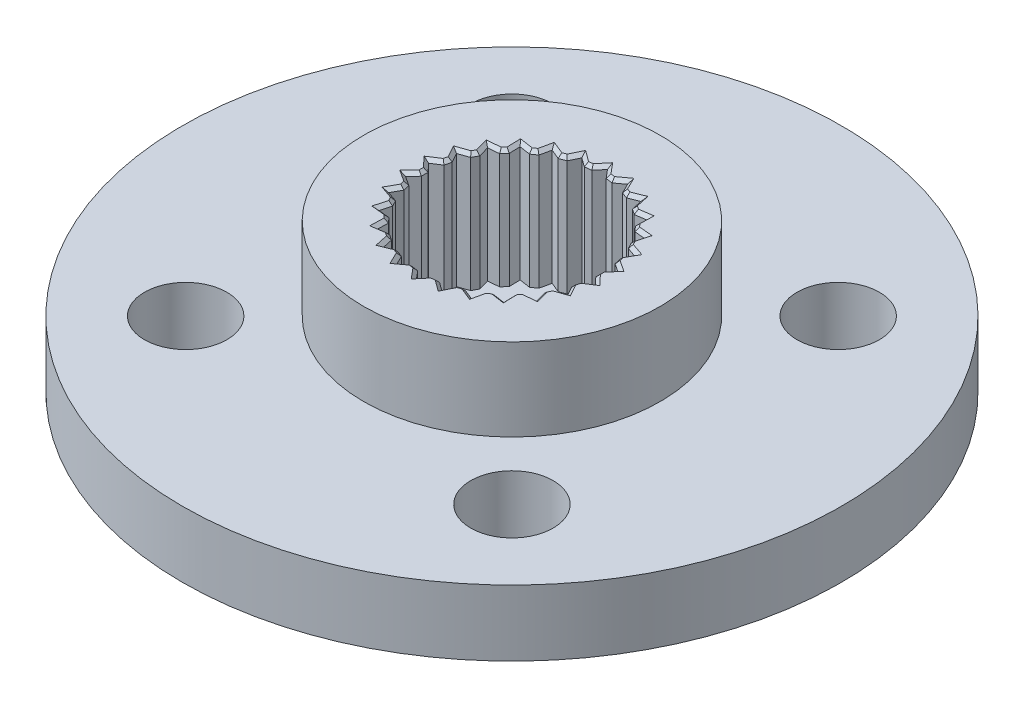
from build123d import *

# Parameters (mm, degrees)
SKETCH1_R           = 10
SKETCH1_R_2         = 1.25
SKETCH1_R_3         = 1.5
BOSS_EXTRUDE1_DEPTH = 2
SKETCH2_R           = 4.5
SKETCH2_R_2         = 1.5
BOSS_EXTRUDE2_DEPTH = 2.5
SKETCH3_R           = 2.25
CUT_EXTRUDE1_DEPTH  = 3.6
CUT_EXTRUDE2_DEPTH  = 3.6
CHAMFER1_SIZE       = 0.1


with BuildPart() as part:
    # Sketch1 → Boss-Extrude1 (new body)
    with BuildSketch(Plane(origin=(0, 0, 0), x_dir=(1, 0, 0), z_dir=(0, 1, 0))):
        with Locations(Location((0, 0, 0), (0, 0, 270))):
            Circle(SKETCH1_R)
        with Locations(Location((-4.949747468, 4.949747468, 0), (0, 0, 270))):
            Circle(SKETCH1_R_2, mode=Mode.SUBTRACT)
        with Locations(Location((4.949747468, 4.949747468, 0), (0, 0, 270))):
            Circle(SKETCH1_R_2, mode=Mode.SUBTRACT)
        with Locations(Location((4.949747468, -4.949747468, 0), (0, 0, 270))):
            Circle(SKETCH1_R_2, mode=Mode.SUBTRACT)
        with Locations(Location((-4.949747468, -4.949747468, 0), (0, 0, 270))):
            Circle(SKETCH1_R_2, mode=Mode.SUBTRACT)
        with Locations(Location((0, 0, 0), (0, 0, 270))):
            Circle(SKETCH1_R_3, mode=Mode.SUBTRACT)
    extrude(amount=BOSS_EXTRUDE1_DEPTH)

    # Sketch2 → Boss-Extrude2 (add)
    with BuildSketch(Plane(origin=(0, 2, 0), x_dir=(1, 0, 0), z_dir=(0, 1, 0))):
        with Locations(Location((0, 0, 0), (0, 0, 270))):
            Circle(SKETCH2_R)
        with Locations(Location((0, 0, 0), (0, 0, 270))):
            Circle(SKETCH2_R_2, mode=Mode.SUBTRACT)
    extrude(amount=BOSS_EXTRUDE2_DEPTH)

    # Sketch3 → Cut-Extrude1 (cut)
    with BuildSketch(Plane(origin=(0, 4.5, 0), x_dir=(1, 0, 0), z_dir=(0, 1, 0))):
        with Locations(Location((0, 0, 0), (0, 0, 270))):
            Circle(SKETCH3_R)
    extrude(amount=-CUT_EXTRUDE1_DEPTH, mode=Mode.SUBTRACT)

    # Sketch7 → Cut-Extrude2 (cut)
    with BuildSketch(Plane(origin=(0, 4.5, 0), x_dir=(1, 0, 0), z_dir=(0, 1, 0))):
        Polygon((-0.842998944, 2.512340101), (-1.034995876, 2.439525269), (-1.129082655, 2.478127827), (-1.347697199, 2.567822474), (-1.398067166, 2.336953865), (-1.419745267, 2.237593211), (-1.588737387, 2.120946373), (-1.689328372, 2.13591077), (-1.923055709, 2.17068117), (-1.916711542, 1.93446686), (-1.913981155, 1.832805537), (-2.050147256, 1.679105783), (-2.151396465, 1.669562343), (-2.386653211, 1.647387766), (-2.32396361, 1.419555673), (-2.296983416, 1.321501868), (-2.392410018, 1.139681668), (-2.488433215, 1.106185022), (-2.711547104, 1.028354172), (-2.59615536, 0.82214507), (-2.54649335, 0.733397313), (-2.595634607, 0.534023397), (-2.680851271, 0.478520248), (-2.878855735, 0.349556373), (-2.717467997, 0.176954384), (-2.648010346, 0.102670372), (-2.648010346, -0.102670372), (-2.717467997, -0.176954384), (-2.878855735, -0.349556373), (-2.680851271, -0.478520248), (-2.595634607, -0.534023397), (-2.54649335, -0.733397313), (-2.59615536, -0.82214507), (-2.711547104, -1.028354172), (-2.488433215, -1.106185022), (-2.392410018, -1.139681668), (-2.296983416, -1.321501868), (-2.32396361, -1.419555673), (-2.386653211, -1.647387766), (-2.151396465, -1.669562343), (-2.050147256, -1.679105783), (-1.913981155, -1.832805537), (-1.916711542, -1.93446686), (-1.923055709, -2.17068117), (-1.689328372, -2.13591077), (-1.588737387, -2.120946373), (-1.419745267, -2.237593211), (-1.398067166, -2.336953865), (-1.347697199, -2.567822474), (-1.129082655, -2.478127827), (-1.034995876, -2.439525269), (-0.842998944, -2.512340101), (-0.798172209, -2.603625605), (-0.694015426, -2.815731271), (-0.503218758, -2.676325101), (-0.421104166, -2.616327824), (-0.217260587, -2.641078915), (-0.151890384, -2.718984089), (0, -2.9), (0.151890384, -2.718984089), (0.217260587, -2.641078915), (0.421104166, -2.616327824), (0.503218758, -2.676325101), (0.694015426, -2.815731271), (0.798172209, -2.603625605), (0.842998944, -2.512340101), (1.034995876, -2.439525269), (1.129082655, -2.478127827), (1.347697199, -2.567822474), (1.398067166, -2.336953865), (1.419745267, -2.237593211), (1.588737387, -2.120946373), (1.689328372, -2.13591077), (1.923055709, -2.17068117), (1.916711542, -1.93446686), (1.913981155, -1.832805537), (2.050147256, -1.679105783), (2.151396465, -1.669562343), (2.386653211, -1.647387766), (2.32396361, -1.419555673), (2.296983416, -1.321501868), (2.392410018, -1.139681668), (2.488433215, -1.106185022), (2.711547104, -1.028354172), (2.59615536, -0.82214507), (2.54649335, -0.733397313), (2.595634607, -0.534023397), (2.680851271, -0.478520248), (2.878855735, -0.349556373), (2.717467997, -0.176954384), (2.648010346, -0.102670372), (2.648010346, 0.102670372), (2.717467997, 0.176954384), (2.878855735, 0.349556373), (2.680851271, 0.478520248), (2.595634607, 0.534023397), (2.54649335, 0.733397313), (2.59615536, 0.82214507), (2.711547104, 1.028354172), (2.488433215, 1.106185022), (2.392410018, 1.139681668), (2.296983416, 1.321501868), (2.32396361, 1.419555673), (2.386653211, 1.647387766), (2.151396465, 1.669562343), (2.050147256, 1.679105783), (1.913981155, 1.832805537), (1.916711542, 1.93446686), (1.923055709, 2.17068117), (1.689328372, 2.13591077), (1.588737387, 2.120946373), (1.419745267, 2.237593211), (1.398067166, 2.336953865), (1.347697199, 2.567822474), (1.129082655, 2.478127827), (1.034995876, 2.439525269), (0.842998944, 2.512340101), (0.798172209, 2.603625605), (0.694015426, 2.815731271), (0.503218758, 2.676325101), (0.421104166, 2.616327824), (0.217260587, 2.641078915), (0.151890384, 2.718984089), (0, 2.9), (-0.151890384, 2.718984089), (-0.217260587, 2.641078915), (-0.421104166, 2.616327824), (-0.503218758, 2.676325101), (-0.694015426, 2.815731271), (-0.798172209, 2.603625605), align=None)
    extrude(amount=-CUT_EXTRUDE2_DEPTH, mode=Mode.SUBTRACT)

    # Chamfer1
    chamfer1_edges = [part.edges().sort_by_distance(p)[0] for p in [
        (-1.755896548, 4.5, 2.145813771),
        (-1.504241327, 4.5, 2.179269792),
        (-1.383721233, 4.5, 2.402707843),
        (-1.191346537, 4.5, 2.503673872),
        (-0.93899741, 4.5, 2.475932685),
        (-0.768507185, 4.5, 2.664035686),
        (-0.557559796, 4.5, 2.716029547),
        (-0.319182376, 4.5, 2.62870337),
        (-0.108630293, 4.5, 2.770539458),
        (0.108630293, 4.5, 2.770539458),
        (0.319182376, 4.5, 2.62870337),
        (0.557559796, 4.5, 2.716029547),
        (0.768507185, 4.5, 2.664035686),
        (0.93899741, 4.5, 2.475932685),
        (1.191346537, 4.5, 2.503673872),
        (1.383721233, 4.5, 2.402707843),
        (1.504241327, 4.5, 2.179269792),
        (1.755896548, 4.5, 2.145813771),
        (1.918518432, 4.5, 2.001743353),
        (1.982064206, 4.5, 1.75595566),
        (2.218400233, 4.5, 1.663246774),
        (2.341818314, 4.5, 1.484444817),
        (2.344696717, 4.5, 1.230591768),
        (2.551978561, 4.5, 1.08401792),
        (2.629020227, 4.5, 0.880875743),
        (2.571063978, 4.5, 0.633710355),
        (2.737245171, 4.5, 0.441789885),
        (2.763433041, 4.5, 0.226113373),
        (2.648010346, 4.5, 0),
        (2.763433041, 4.5, -0.226113373),
        (2.737245171, 4.5, -0.441789885),
        (2.571063978, 4.5, -0.633710355),
        (2.629020227, 4.5, -0.880875743),
        (2.551978561, 4.5, -1.08401792),
        (2.344696717, 4.5, -1.230591768),
        (2.341818314, 4.5, -1.484444817),
        (2.218400233, 4.5, -1.663246774),
        (1.982064206, 4.5, -1.75595566),
        (1.918518432, 4.5, -2.001743353),
        (1.755896548, 4.5, -2.145813771),
        (1.504241327, 4.5, -2.179269792),
        (1.383721233, 4.5, -2.402707843),
        (1.191346537, 4.5, -2.503673872),
        (0.93899741, 4.5, -2.475932685),
        (0.768507185, 4.5, -2.664035686),
        (0.557559796, 4.5, -2.716029547),
        (0.319182376, 4.5, -2.62870337),
        (0.108630293, 4.5, -2.770539458),
        (-0.108630293, 4.5, -2.770539458),
        (-0.319182376, 4.5, -2.62870337),
        (-0.557559796, 4.5, -2.716029547),
        (-0.768507185, 4.5, -2.664035686),
        (-0.93899741, 4.5, -2.475932685),
        (-1.191346537, 4.5, -2.503673872),
        (-1.383721233, 4.5, -2.402707843),
        (-1.504241327, 4.5, -2.179269792),
        (-1.755896548, 4.5, -2.145813771),
        (-1.918518432, 4.5, -2.001743353),
        (-1.982064206, 4.5, -1.75595566),
        (-2.218400233, 4.5, -1.663246774),
        (-2.341818314, 4.5, -1.484444817),
        (-2.344696717, 4.5, -1.230591768),
        (-2.551978561, 4.5, -1.08401792),
        (-2.629020227, 4.5, -0.880875743),
        (-2.571063978, 4.5, -0.633710355),
        (-2.737245171, 4.5, -0.441789885),
        (-2.763433041, 4.5, -0.226113373),
        (-2.648010346, 4.5, 0),
        (-2.763433041, 4.5, 0.226113373),
        (-2.737245171, 4.5, 0.441789885),
        (-2.571063978, 4.5, 0.633710355),
        (-2.629020227, 4.5, 0.880875743),
        (-2.551978561, 4.5, 1.08401792),
        (-2.344696717, 4.5, 1.230591768),
        (-2.341818314, 4.5, 1.484444817),
        (-2.218400233, 4.5, 1.663246774),
        (-1.982064206, 4.5, 1.75595566),
        (-1.918518432, 4.5, 2.001743353),
    ]]
    chamfer(chamfer1_edges, length=CHAMFER1_SIZE)


solid = part.part
